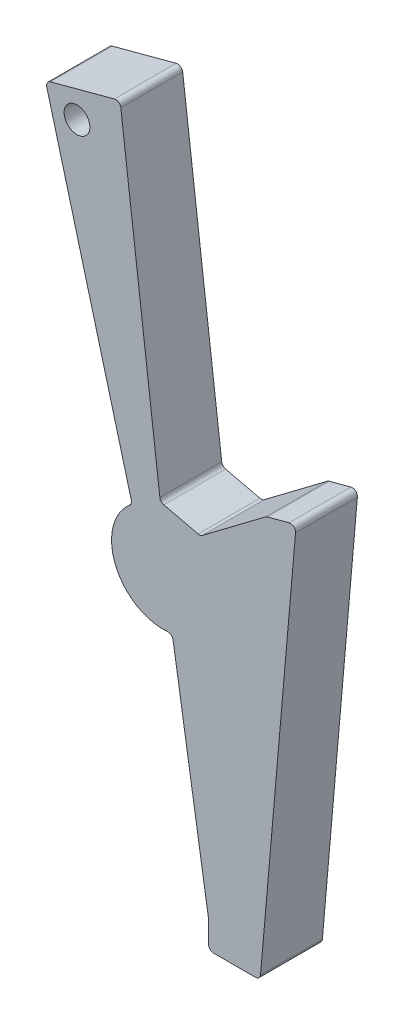
from build123d import *

# Parameters (mm, degrees)
BOSS_EXTRUDE1_DEPTH = 12
SKETCH2_R           = 2.5
CUT_EXTRUDE1_DEPTH  = 139.979288596
FILLET1_R           = 1


with BuildPart() as part:
    # Sketch1 → Boss-Extrude1 (new body)
    with BuildSketch(Plane.XY):
        with BuildLine():
            Line((0, 0), (-14.488887394, -3.882285677))
            Line((-14.488887394, -3.882285677), (2.334350537, -66.667464385))
            ThreePointArc((2.334350537, -66.667464385), (-0.8237016, -78.663286709), (10.120361434, -84.502852689))
            Line((10.120361434, -84.502852689), (17.159912361, -128.948828016))
            Line((17.159912361, -128.948828016), (17.159912361, -134.180494133))
            Line((17.159912361, -134.180494133), (27.159912361, -134.180494133))
            Line((27.159912361, -134.180494133), (34.159005443, -54.180494133))
            Line((34.159005443, -54.180494133), (28.363450485, -55.733408403))
            Line((28.363450485, -55.733408403), (15.585282325, -65.362448774))
            Line((15.585282325, -65.362448774), (7.799637978, -63.522953705))
            Line((7.799637978, -63.522953705), (0, 0))
        make_face()
    extrude(amount=BOSS_EXTRUDE1_DEPTH)

    # Sketch2 → Cut-Extrude1 (cut, through all)
    with BuildSketch(Plane.XY.offset(12)):
        with Locations((-8.365163037, -7.417819582)):
            Circle(SKETCH2_R)
    extrude(amount=-CUT_EXTRUDE1_DEPTH, mode=Mode.SUBTRACT)

    # Fillet1
    fillet1_edges = [part.edges().sort_by_distance(p)[0] for p in [
        (7.799637978, -63.522953705, 6),
        (15.585282325, -65.362448774, 6),
        (28.363450485, -55.733408403, 6),
        (34.159005443, -54.180494133, 6),
        (27.159912361, -134.180494133, 6),
        (17.159912361, -134.180494133, 6),
        (10.120361434, -84.502852689, 6),
        (2.334350537, -66.667464385, 6),
        (-14.488887394, -3.882285677, 6),
        (0, 0, 6),
    ]]
    fillet(fillet1_edges, radius=FILLET1_R)


solid = part.part
